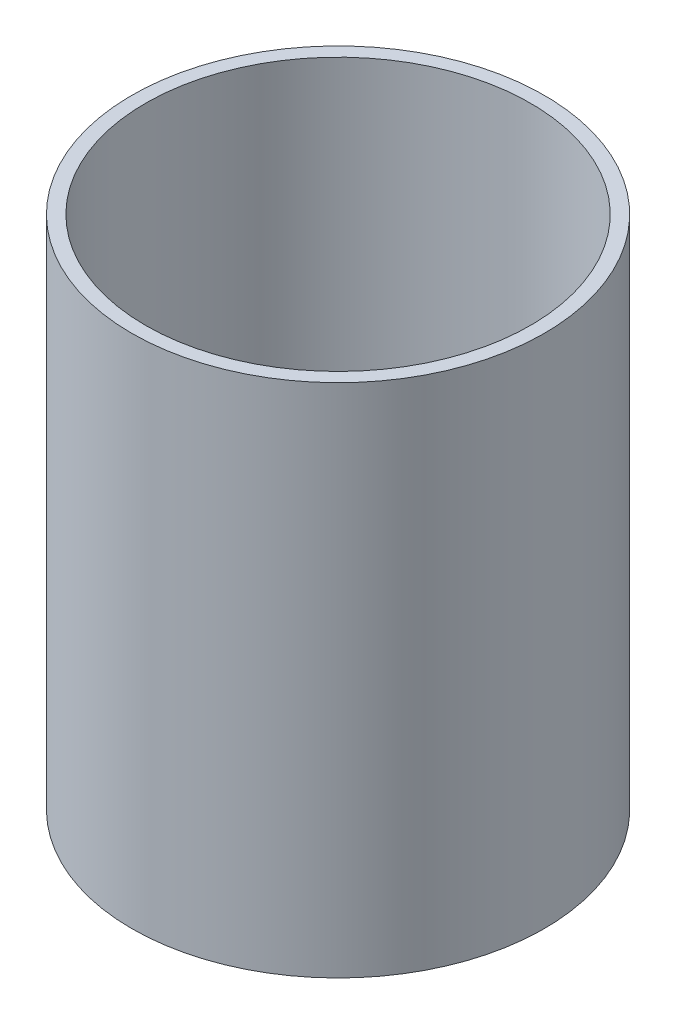
from build123d import *

# Parameters (mm, degrees)
SKETCH2_R           = 6
SKETCH2_R_2         = 5.6
BOSS_EXTRUDE1_DEPTH = 15


with BuildPart() as part:
    # Sketch2 → Boss-Extrude1 (new body)
    with BuildSketch(Plane(origin=(0, 0, 0), x_dir=(1, 0, 0), z_dir=(0, 1, 0))):
        with Locations(Location((0, 0, 0), (0, 0, 270))):
            Circle(SKETCH2_R)
        with Locations(Location((0, 0, 0), (0, 0, 270))):
            Circle(SKETCH2_R_2, mode=Mode.SUBTRACT)
    extrude(amount=BOSS_EXTRUDE1_DEPTH)


solid = part.part
